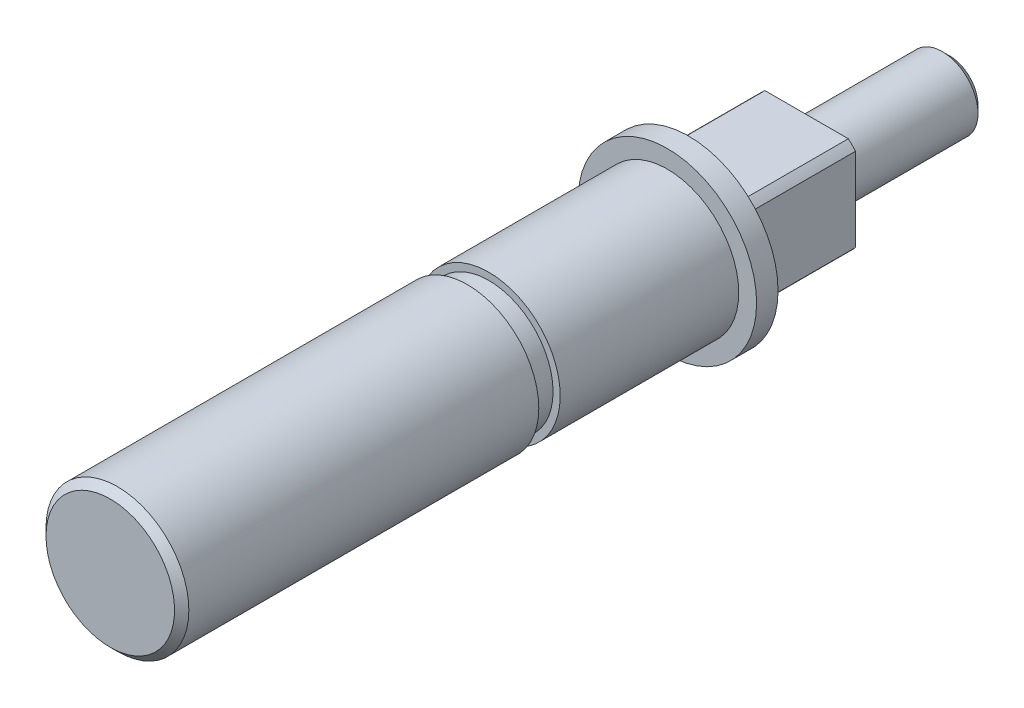
from build123d import *

# Parameters (mm, degrees)
SKETCH_2_OUTSIDE_W   = 51.54
SKETCH_2_OUTSIDE_H   = 51.54
SKETCH_2_OUTSIDE_W_2 = 13.7
SKETCH_2_OUTSIDE_H_2 = 13.7
CUT_EXTRUDE_1_DEPTH  = 16.5
CHAMFER_1_SIZE       = 1


with BuildPart() as part:
    # 草图1 → 旋转1 (revolve)
    with BuildSketch(Plane(origin=(0, 0, 0), x_dir=(0, 0, -1), z_dir=(1, 0, 0)), mode=Mode.PRIVATE) as revolve_1_sk:
        Polygon((-117.5, 0), (0, 0), (0, 5), (-20, 5), (-20, 9), (-36.5, 9), (-36.5, 12.5), (-39.5, 12.5), (-39.5, 10), (-64.5, 10), (-64.5, 9), (-67.5, 9), (-67.5, 10), (-117.5, 10), align=None)
    revolve(revolve_1_sk.sketch.rotate(Axis((0, 0, 117.5), (0, 0, -1)), 90), axis=Axis((0, 0, 117.5), (0, 0, -1)))

    # 草图2 outside → 切除-拉伸1 (cut)
    with BuildSketch(Plane(origin=(0, 0, 20), x_dir=(-1, 0, 0), z_dir=(0, 0, -1))):
        Rectangle(SKETCH_2_OUTSIDE_W, SKETCH_2_OUTSIDE_H)
        Rectangle(SKETCH_2_OUTSIDE_W_2, SKETCH_2_OUTSIDE_H_2, mode=Mode.SUBTRACT)
    extrude(amount=-CUT_EXTRUDE_1_DEPTH, mode=Mode.SUBTRACT)

    # 倒角1
    chamfer_1_edges = [part.edges().sort_by_distance(p)[0] for p in [
        (-5, 0, 0),
        (-10, 0, 117.5),
    ]]
    chamfer(chamfer_1_edges, length=CHAMFER_1_SIZE)


solid = part.part
